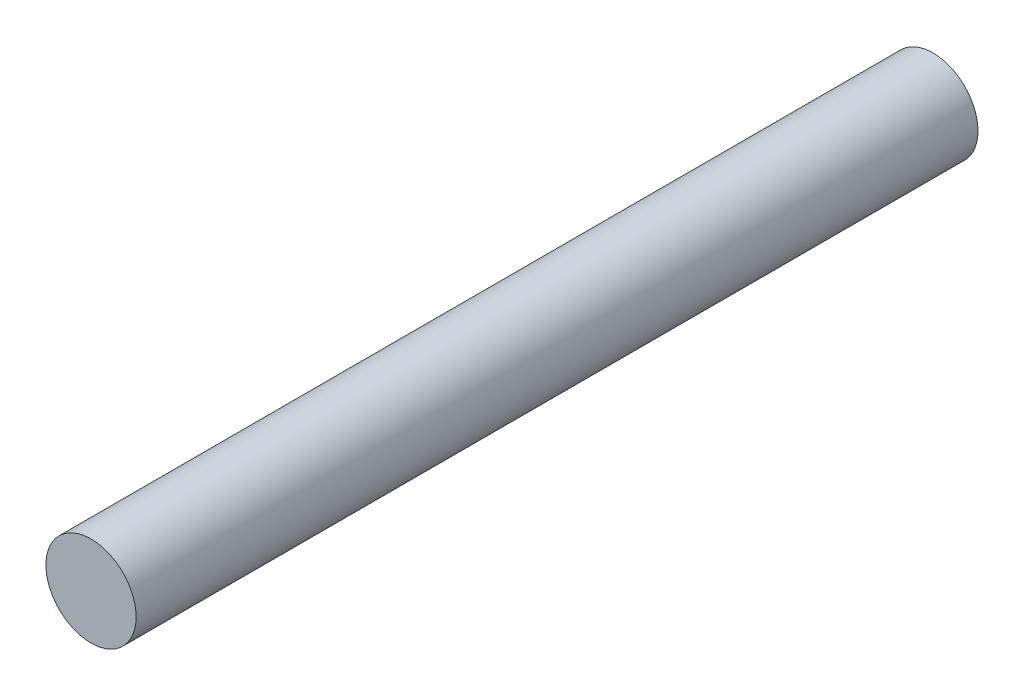
from build123d import *

# Parameters (mm, degrees)
SKETCH_2_R      = 15
EXTRUDE_2_DEPTH = 280


with BuildPart() as part:
    # 草图2 → 凸台-拉伸2 (new body)
    with BuildSketch(Plane.XY):
        with Locations((-52.448976176, 6.948389682)):
            Circle(SKETCH_2_R)
    extrude(amount=EXTRUDE_2_DEPTH)


solid = part.part
